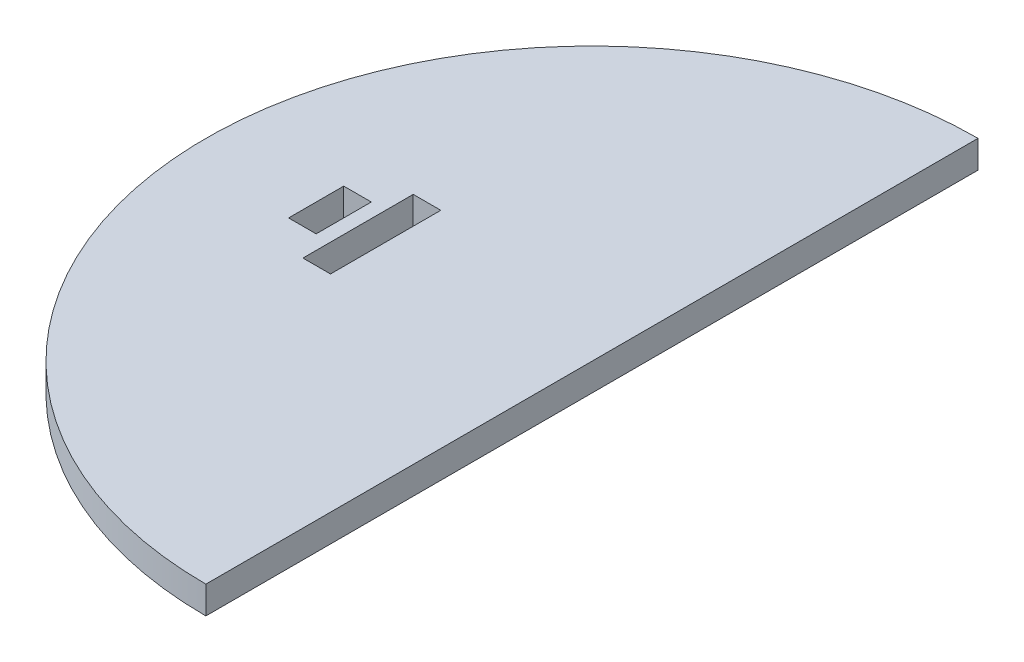
from build123d import *

# Parameters (mm, degrees)
SKETCH1_W           = 5
SKETCH1_H           = 10
BOSS_EXTRUDE1_DEPTH = 5
CUT_EXTRUDE1_DEPTH  = 10


with BuildPart() as part:
    # Sketch1 → Boss-Extrude1 (new body)
    with BuildSketch(Plane(origin=(0, 0, 0), x_dir=(1, 0, 0), z_dir=(0, 1, 0))):
        with BuildLine():
            Line((0, 70), (0, -70))
            ThreePointArc((0, -70), (-70, 0), (0, 70))
        make_face()
        with Locations((-47.5, 0)):
            Rectangle(SKETCH1_W, SKETCH1_H, mode=Mode.SUBTRACT)
    extrude(amount=BOSS_EXTRUDE1_DEPTH)

    # Sketch2 → Cut-Extrude1 (cut)
    with BuildSketch(Plane(origin=(0, 5, 0), x_dir=(1, 0, 0), z_dir=(0, 1, 0))):
        Polygon((-37.4, 0), (-37.4, -10), (-42.4, -10), (-42.4, 10), (-37.4, 10), align=None)
    extrude(amount=-CUT_EXTRUDE1_DEPTH, mode=Mode.SUBTRACT)


solid = part.part
